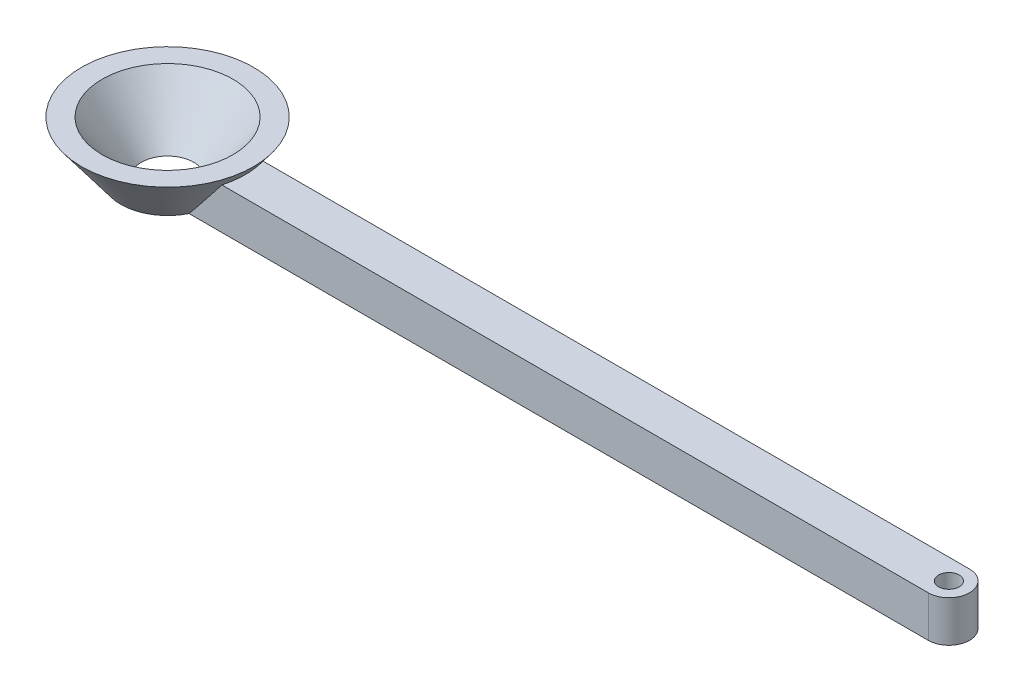
from build123d import *

# Parameters (mm, degrees)
SKETCH1_R           = 2.5
BOSS_EXTRUDE2_DEPTH = 10


with BuildPart() as part:
    # Sketch1 → Boss-Extrude2 (new body)
    with BuildSketch(Plane(origin=(0, 0, 0), x_dir=(1, 0, 0), z_dir=(0, 1, 0))):
        with BuildLine():
            ThreePointArc((90, 5), (95, 0), (90, -5))
            Line((90, -5), (-90, -5))
            Line((-90, -5), (-90, 5))
            Line((-90, 5), (90, 5))
        make_face()
        with Locations(Location((90, 0, 0), (0, 0, 270))):
            Circle(SKETCH1_R, mode=Mode.SUBTRACT)
    extrude(amount=BOSS_EXTRUDE2_DEPTH)

    # Sketch6 → Revolve2 (revolve)
    with BuildSketch(Plane.XY, mode=Mode.PRIVATE) as revolve2_sk:
        Polygon((-88.175, 0), (-78.65, 12.7), (-83.65, 12.7), (-93.175, 0), align=None)
    revolve(revolve2_sk.sketch.rotate(Axis((-99.525, 14.826221604, 0), (0, -1, 0)), 90), axis=Axis((-99.525, 14.826221604, 0), (0, -1, 0)))

    # Sketch7 → Cut-Revolve1 (revolve, cut)
    with BuildSketch(Plane.XY):
        Polygon((-83.65, 12.7), (-93.175, 0), (-99.525, 0), (-99.525, 12.7), align=None)
    revolve(axis=Axis((-99.525, 12.7, 0), (0, -1, 0)), mode=Mode.SUBTRACT)


solid = part.part
